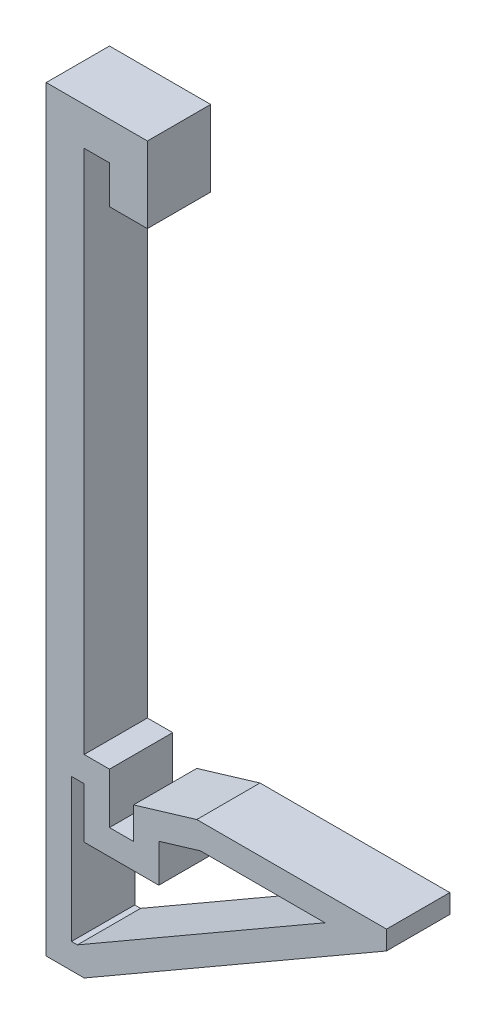
from build123d import *

# Parameters (mm, degrees)
EXTRUDE_1_DEPTH     = 5
CUT_EXTRUDE_1_DEPTH = 66.760863021


with BuildPart() as part:
    # 草图1 → 凸台-拉伸1 (new body)
    with BuildSketch(Plane.XY):
        Polygon((0, 0), (0, 59.798671434), (8, 59.798671434), (8, 53.798671434), (5, 53.798671434), (5, 56.798671434), (3, 56.798671434), (3, 15.298671434), (5, 15.298671434), (5, 11.298671434), (6.9, 11.298671434), (6.9, 13.798671434), (11.9, 15.298671434), (26.9, 15.298671434), (26.9, 13.798671434), (3, 0), align=None)
    extrude(amount=EXTRUDE_1_DEPTH)

    # 草图2 → 切除-拉伸1 (cut, through all)
    with BuildSketch(Plane.XY.offset(5)):
        Polygon((22.033974596, 13.298671434), (12.193537673, 13.298671434), (8.9, 12.310610132), (8.9, 9.298671434), (3, 9.298671434), (3, 13.298671434), (2, 13.298671434), (2, 2), (2.464101615, 2), align=None)
    extrude(amount=-CUT_EXTRUDE_1_DEPTH, mode=Mode.SUBTRACT)


solid = part.part
